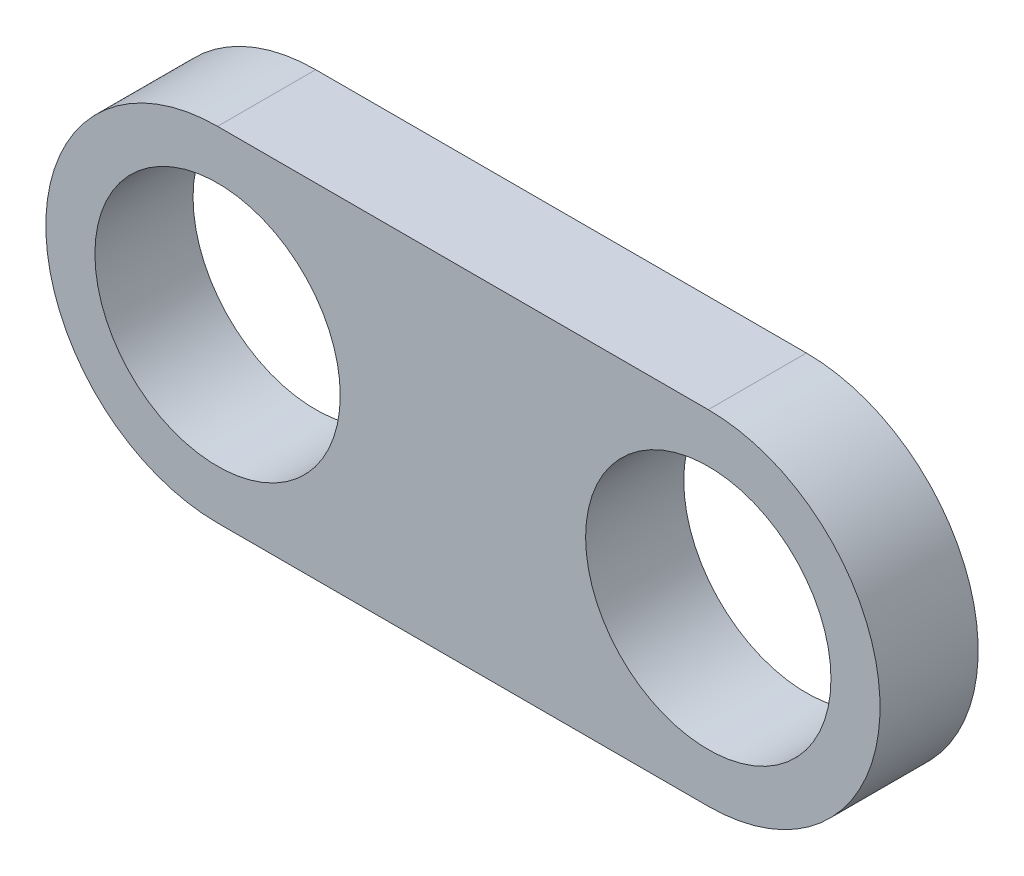
from build123d import *

# Parameters (mm, degrees)
SKETCH_1_R      = 25
EXTRUDE_1_DEPTH = 20


with BuildPart() as part:
    # Эскиз1 → Бобышка-Вытянуть1 (new body)
    with BuildSketch(Plane.XY):
        with BuildLine():
            Line((0, 35), (100, 35))
            ThreePointArc((100, 35), (135, 0), (100, -35))
            Line((100, -35), (0, -35))
            ThreePointArc((0, -35), (-35, 0), (0, 35))
        make_face()
        Circle(SKETCH_1_R, mode=Mode.SUBTRACT)
        with Locations((100, 0)):
            Circle(SKETCH_1_R, mode=Mode.SUBTRACT)
    extrude(amount=EXTRUDE_1_DEPTH)


solid = part.part
